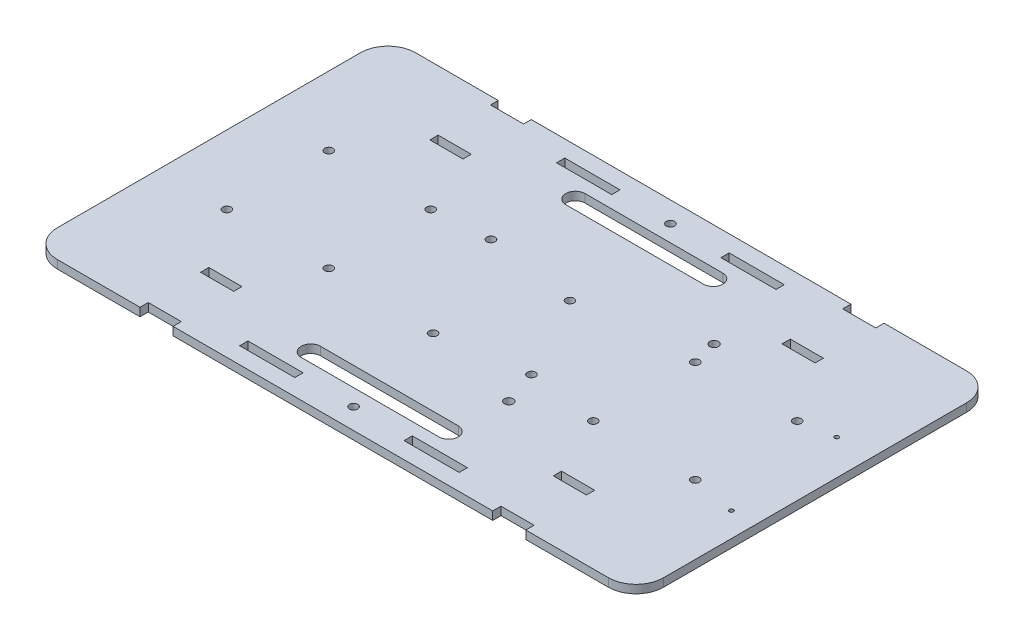
from build123d import *

# Parameters (mm, degrees)
BOSS_EXTRUDE1_DEPTH = 3
SKETCH2_R           = 1.5
SKETCH2_W           = 12
SKETCH2_H           = 3
SKETCH2_H_2         = 2.8
SKETCH2_W_2         = 20
CUT_EXTRUDE1_DEPTH  = 3
SKETCH4_R           = 1.6
CUT_EXTRUDE3_DEPTH  = 3
SKETCH5_R           = 1.5
SKETCH5_R_2         = 1.475
CUT_EXTRUDE4_DEPTH  = 3
SKETCH6_R           = 0.75
CUT_EXTRUDE5_DEPTH  = 3
CUT_EXTRUDE6_DEPTH  = 3


with BuildPart() as part:
    # Sketch1 → Boss-Extrude1 (new body)
    with BuildSketch(Plane(origin=(0, 0, 0), x_dir=(1, 0, 0), z_dir=(0, 1, 0))):
        with BuildLine():
            Line((100, -65), (-100, -65))
            ThreePointArc((-100, -65), (-107.071067812, -62.071067812), (-110, -55))
            Line((-110, -55), (-110, 55))
            ThreePointArc((-110, 55), (-107.071067812, 62.071067812), (-100, 65))
            Line((-100, 65), (100, 65))
            ThreePointArc((100, 65), (107.071067812, 62.071067812), (110, 55))
            Line((110, 55), (110, -55))
            ThreePointArc((110, -55), (107.071067812, -62.071067812), (100, -65))
        make_face()
    extrude(amount=BOSS_EXTRUDE1_DEPTH)

    # Sketch2 → Cut-Extrude1 (cut)
    with BuildSketch(Plane(origin=(0, 3, 0), x_dir=(1, 0, 0), z_dir=(0, 1, 0))):
        with Locations(Location((-85, 18.5, 0), (0, 0, 270))):
            Circle(SKETCH2_R)
        with Locations(Location((-48, 18.5, 0), (0, 0, 270))):
            Circle(SKETCH2_R)
        with Locations(Location((-85, -18.5, 0), (0, 0, 270))):
            Circle(SKETCH2_R)
        with Locations(Location((-48, -18.5, 0), (0, 0, 270))):
            Circle(SKETCH2_R)
        with Locations(Location((48, -18.5, 0), (0, 0, 90))):
            Circle(SKETCH2_R)
        with Locations(Location((85, -18.5, 0), (0, 0, 90))):
            Circle(SKETCH2_R)
        with Locations(Location((48, 18.5, 0), (0, 0, 90))):
            Circle(SKETCH2_R)
        with Locations(Location((85, 18.5, 0), (0, 0, 90))):
            Circle(SKETCH2_R)
        with Locations(Location((0, -57.5, 0), (0, 0, 270))):
            Circle(SKETCH2_R)
        with Locations(Location((0, 57.5, 0), (0, 0, 90))):
            Circle(SKETCH2_R)
        with Locations((64, -63.5)):
            Rectangle(SKETCH2_W, SKETCH2_H)
        with Locations((64, 63.5)):
            Rectangle(SKETCH2_W, SKETCH2_H)
        with Locations((-64, -63.5)):
            Rectangle(SKETCH2_W, SKETCH2_H)
        with Locations((-64, 63.6)):
            Rectangle(SKETCH2_W, SKETCH2_H_2)
        with Locations((-64, 41.7)):
            Rectangle(SKETCH2_W, SKETCH2_H)
        with Locations((64, 41.5)):
            Rectangle(SKETCH2_W, SKETCH2_H)
        with Locations((64, -41.5)):
            Rectangle(SKETCH2_W, SKETCH2_H)
        with Locations((-64, -41.5)):
            Rectangle(SKETCH2_W, SKETCH2_H)
        with Locations((29.820667629, -57.5)):
            Rectangle(SKETCH2_W_2, SKETCH2_H)
        with Locations((-29.820667629, -57.5)):
            Rectangle(SKETCH2_W_2, SKETCH2_H)
        with Locations((-29.820667629, 57.5)):
            Rectangle(SKETCH2_W_2, SKETCH2_H)
        with Locations((29.820667629, 57.5)):
            Rectangle(SKETCH2_W_2, SKETCH2_H)
    extrude(amount=-CUT_EXTRUDE1_DEPTH, mode=Mode.SUBTRACT)

    # Sketch4 → Cut-Extrude3 (cut)
    with BuildSketch(Plane(origin=(0, 3, 0), x_dir=(1, 0, 0), z_dir=(0, 1, 0))):
        with Locations(Location((26.468228909, -27.625, 0), (0, 0, 270))):
            Circle(SKETCH4_R)
        with Locations(Location((45.718228909, 27.625, 0), (0, 0, 270))):
            Circle(SKETCH4_R)
    extrude(amount=-CUT_EXTRUDE3_DEPTH, mode=Mode.SUBTRACT)

    # Sketch5 → Cut-Extrude4 (cut)
    with BuildSketch(Plane.XZ):
        with Locations(Location((-27.638314588, -20, 0), (0, 0, 270))):
            Circle(SKETCH5_R)
        with Locations(Location((-8.638314588, 20, 0), (0, 0, 270))):
            Circle(SKETCH5_R)
        with Locations(Location((22.163922177, 15.1, 0), (0, 0, 270))):
            Circle(SKETCH5_R_2)
        with Locations(Location((5.913922177, -15.1, 0), (0, 0, 270))):
            Circle(SKETCH5_R_2)
    extrude(amount=-CUT_EXTRUDE4_DEPTH, mode=Mode.SUBTRACT)

    # Sketch6 → Cut-Extrude5 (cut)
    with BuildSketch(Plane(origin=(0, 3, 0), x_dir=(1, 0, 0), z_dir=(0, 1, 0))):
        with Locations(Location((101.22716255, -21.591786593, 0), (0, 0, 270))):
            Circle(SKETCH6_R)
        with Locations(Location((97.22716255, 20.608213407, 0), (0, 0, 270))):
            Circle(SKETCH6_R)
    extrude(amount=-CUT_EXTRUDE5_DEPTH, mode=Mode.SUBTRACT)

    # Sketch7 → Cut-Extrude6 (cut)
    with BuildSketch(Plane(origin=(0, 3, 0), x_dir=(1, 0, 0), z_dir=(0, 1, 0))):
        with BuildLine():
            Line((-25, -44.5), (25, -44.5))
            ThreePointArc((25, -44.5), (28.5, -48), (25, -51.5))
            Line((25, -51.5), (-25, -51.5))
            ThreePointArc((-25, -51.5), (-28.5, -48), (-25, -44.5))
        make_face()
        with BuildLine():
            Line((-25, 51.5), (25, 51.5))
            ThreePointArc((25, 51.5), (28.5, 48), (25, 44.5))
            Line((25, 44.5), (-25, 44.5))
            ThreePointArc((-25, 44.5), (-28.5, 48), (-25, 51.5))
        make_face()
    extrude(amount=-CUT_EXTRUDE6_DEPTH, mode=Mode.SUBTRACT)


solid = part.part
